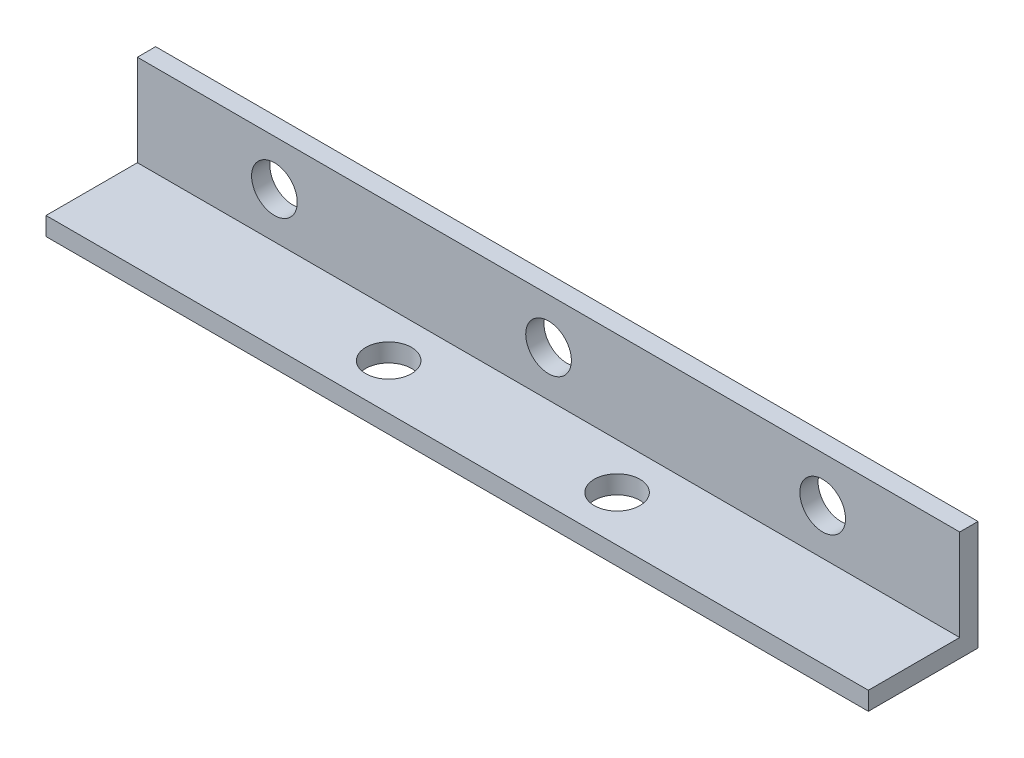
from build123d import *

# Parameters (mm, degrees)
SKETCH1_W               = 90
SKETCH1_H               = 12
BOSS_EXTRUDE1_DEPTH     = 2
SKETCH2_W               = 90
SKETCH2_H               = 2
BOSS_EXTRUDE2_DEPTH     = 10
CUT_EXTRUDE1_DEPTH      = 63.420894383
CUT_EXTRUDE1_DEPTH_BACK = 63.420894383
SKETCH3_R               = 2.5
CUT_EXTRUDE2_DEPTH      = 64.477248768
CUT_EXTRUDE2_DEPTH_BACK = 64.477248768
SKETCH4_R               = 2.5


with BuildPart() as part:
    # Sketch1 → Boss-Extrude1 (new body)
    with BuildSketch(Plane(origin=(0, 0, 0), x_dir=(1, 0, 0), z_dir=(0, 1, 0))):
        with Locations((-16.166666667, 1.416666667)):
            Rectangle(SKETCH1_W, SKETCH1_H)
    extrude(amount=BOSS_EXTRUDE1_DEPTH)

    # Sketch2 → Boss-Extrude2 (add)
    with BuildSketch(Plane(origin=(0, 2, 0), x_dir=(1, 0, 0), z_dir=(0, 1, 0))):
        with Locations((-16.166666667, 6.416666667)):
            Rectangle(SKETCH2_W, SKETCH2_H)
    extrude(amount=BOSS_EXTRUDE2_DEPTH)

    # Sketch3 → Cut-Extrude1 (cut, two sides: drawn at the far end of the back side and taken through both)
    with BuildSketch(Plane(origin=(0, 2, 0), x_dir=(1, 0, 0), z_dir=(0, 1, 0)).offset(-CUT_EXTRUDE1_DEPTH_BACK)):
        with Locations(Location((-28.666666667, 0.416666667, 0), (0, 0, 270))):
            Circle(SKETCH3_R)
        with Locations(Location((-3.666666667, 0.416666667, 0), (0, 0, 270))):
            Circle(SKETCH3_R)
    extrude(amount=CUT_EXTRUDE1_DEPTH + CUT_EXTRUDE1_DEPTH_BACK, mode=Mode.SUBTRACT)

    # Sketch4 → Cut-Extrude2 (cut, two sides: drawn at the far end of the back side and taken through both)
    with BuildSketch(Plane(origin=(0, 0, -7.416666667), x_dir=(-1, 0, 0), z_dir=(0, 0, -1)).offset(-CUT_EXTRUDE2_DEPTH_BACK)):
        with Locations((-13.833333333, 7)):
            Circle(SKETCH4_R)
        with Locations((16.166666667, 7)):
            Circle(SKETCH4_R)
        with Locations((46.166666667, 7)):
            Circle(SKETCH4_R)
    extrude(amount=CUT_EXTRUDE2_DEPTH + CUT_EXTRUDE2_DEPTH_BACK, mode=Mode.SUBTRACT)


solid = part.part
